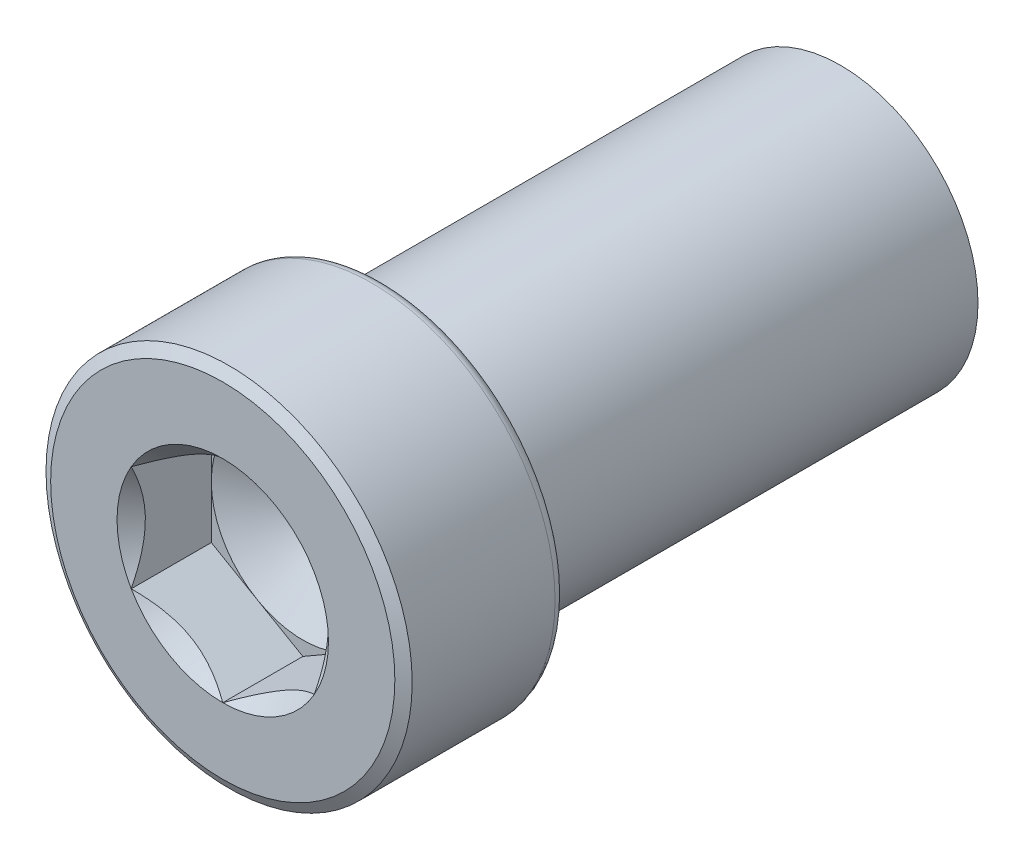
from build123d import *

# Parameters (mm, degrees)
SKETCH1_W          = 20
SKETCH1_H          = 6
SKETCH4_R          = 8
EXTRUDE1_DEPTH     = 7
FILLET1_R          = 0.48
CHAMFER1_SIZE      = 0.48
CHAMFER1_SIZE2     = 0.277128129
CUT_EXTRUDE1_DEPTH = 3.5
SKETCH7_R          = 4.618802154
CUT_EXTRUDE4_DEPTH = 3.5
CUT_EXTRUDE4_DRAFT = -45
SKETCH8_R          = 4
CUT_EXTRUDE5_DEPTH = 1.166666667
CUT_EXTRUDE5_DRAFT = -60


with BuildPart() as part:
    # Sketch1 → Revolve1 (revolve)
    with BuildSketch(Plane(origin=(0, 0, 0), x_dir=(0, 0, -1), z_dir=(1, 0, 0))):
        with Locations((10, 3)):
            Rectangle(SKETCH1_W, SKETCH1_H)
    revolve(axis=Axis((0, 0, 0), (0, 0, 1)))

    # Sketch4 → Extrude1 (add)
    with BuildSketch(Plane.XY):
        Circle(SKETCH4_R)
    extrude(amount=EXTRUDE1_DEPTH)

    # Fillet1
    fillet1_edges = [part.edges().sort_by_distance(p)[0] for p in [
        (-8, 0, 0),
    ]]
    fillet(fillet1_edges, radius=FILLET1_R)

    # Chamfer1
    chamfer1_edges = [part.edges().sort_by_distance(p)[0] for p in [
        (-8, 0, 7),
    ]]
    chamfer1_side = [part.faces().sort_by_distance(p)[0] for p in [
        (0, 0, 7),
    ]]
    chamfer(chamfer1_edges, length=CHAMFER1_SIZE, length2=CHAMFER1_SIZE2, reference=chamfer1_side[0])

    # Sketch6 → Cut-Extrude1 (cut)
    with BuildSketch(Plane.XY.offset(7)):
        Polygon((0, -4.618802154), (4, -2.309401077), (4, 2.309401077), (0, 4.618802154), (-4, 2.309401077), (-4, -2.309401077), align=None)
    extrude(amount=-CUT_EXTRUDE1_DEPTH, mode=Mode.SUBTRACT)


with BuildPart() as cut_extrude4_tool:
    # Sketch7 → Cut-Extrude4 (with draft: the straight prism first)
    with BuildSketch(Plane.XY.offset(7)):
        Circle(SKETCH7_R)
    extrude(amount=-CUT_EXTRUDE4_DEPTH)
    # Cut-Extrude4: the draft: its side faces are tilted about the plane it starts from
    cut_extrude4_sides = [cut_extrude4_tool.faces().sort_by_distance(p)[0] for p in [
        (-4.618802154, 0, 5.25),
    ]]
    draft(cut_extrude4_sides, Plane.XY.offset(7), CUT_EXTRUDE4_DRAFT)


with BuildPart() as part_1:
    add(part.part)

    # Cut-Extrude4: cut by cut_extrude4_tool
    add(cut_extrude4_tool.part, mode=Mode.SUBTRACT)


with BuildPart() as cut_extrude5_tool:
    # Sketch8 → Cut-Extrude5 (with draft: the straight prism first)
    with BuildSketch(Plane.XY.offset(3.5)):
        Circle(SKETCH8_R)
    extrude(amount=-CUT_EXTRUDE5_DEPTH)
    # Cut-Extrude5: the draft: its side faces are tilted about the plane it starts from
    cut_extrude5_sides = [cut_extrude5_tool.faces().sort_by_distance(p)[0] for p in [
        (-4, 0, 2.916666667),
    ]]
    draft(cut_extrude5_sides, Plane.XY.offset(3.5), CUT_EXTRUDE5_DRAFT)


with BuildPart() as part_2:
    add(part_1.part)

    # Cut-Extrude5: cut by cut_extrude5_tool
    add(cut_extrude5_tool.part, mode=Mode.SUBTRACT)


solid = part_2.part
